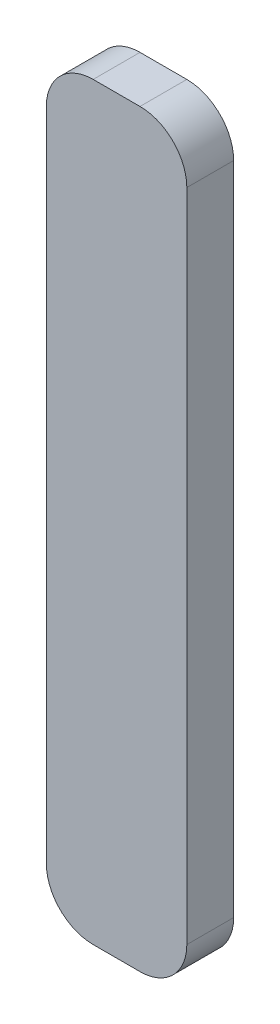
from build123d import *

# Parameters (mm, degrees)
SKICA1_W                = 30
SKICA1_H                = 160
P_IDAT_VYSUNUT_M1_DEPTH = 10
ZAOBLIT1_R              = 10


with BuildPart() as part:
    # Skica1 → Přidat vysunutím1 (new body)
    with BuildSketch(Plane.XY):
        with Locations((15, 80)):
            Rectangle(SKICA1_W, SKICA1_H)
    extrude(amount=P_IDAT_VYSUNUT_M1_DEPTH)

    # Zaoblit1
    zaoblit1_edges = [part.edges().sort_by_distance(p)[0] for p in [
        (0, 160, 5),
        (30, 160, 5),
        (30, 0, 5),
        (0, 0, 5),
    ]]
    fillet(zaoblit1_edges, radius=ZAOBLIT1_R)


solid = part.part
